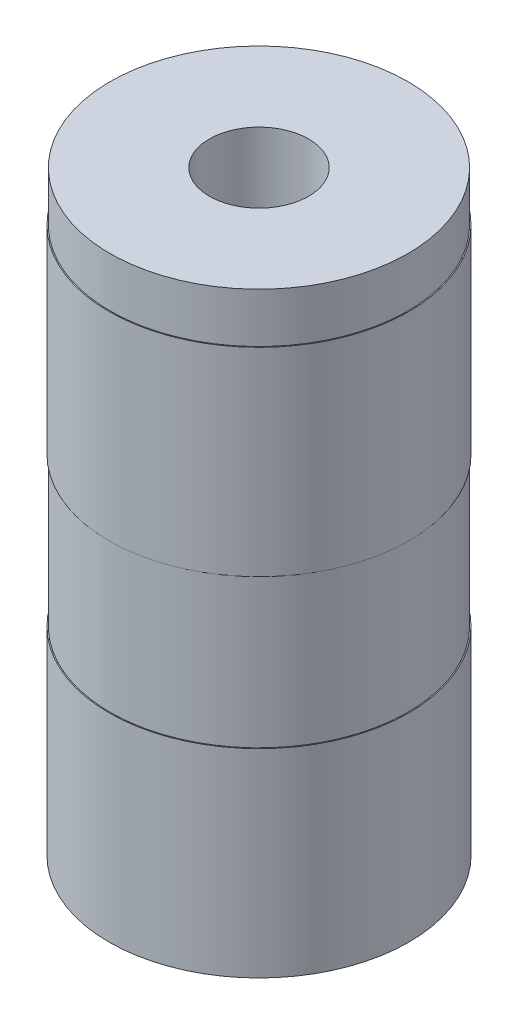
from build123d import *

# Parameters (mm, degrees)
SKETCH1_W   = 10
SKETCH1_H   = 60
SKETCH1_W_2 = 0.1
SKETCH1_H_2 = 20


with BuildPart() as part:
    # Sketch1 → Revolve1 (revolve)
    with BuildSketch(Plane.XY, mode=Mode.PRIVATE) as revolve1_sk:
        with Locations((10, 30)):
            Rectangle(SKETCH1_W, SKETCH1_H)
        with Locations((15.05, 45)):
            Rectangle(SKETCH1_W_2, SKETCH1_H_2)
        with Locations((15.05, 10)):
            Rectangle(SKETCH1_W_2, SKETCH1_H_2)
    revolve(revolve1_sk.sketch.rotate(Axis((0, 0, 0), (0, 1, 0)), 90), axis=Axis((0, 0, 0), (0, 1, 0)))


solid = part.part
